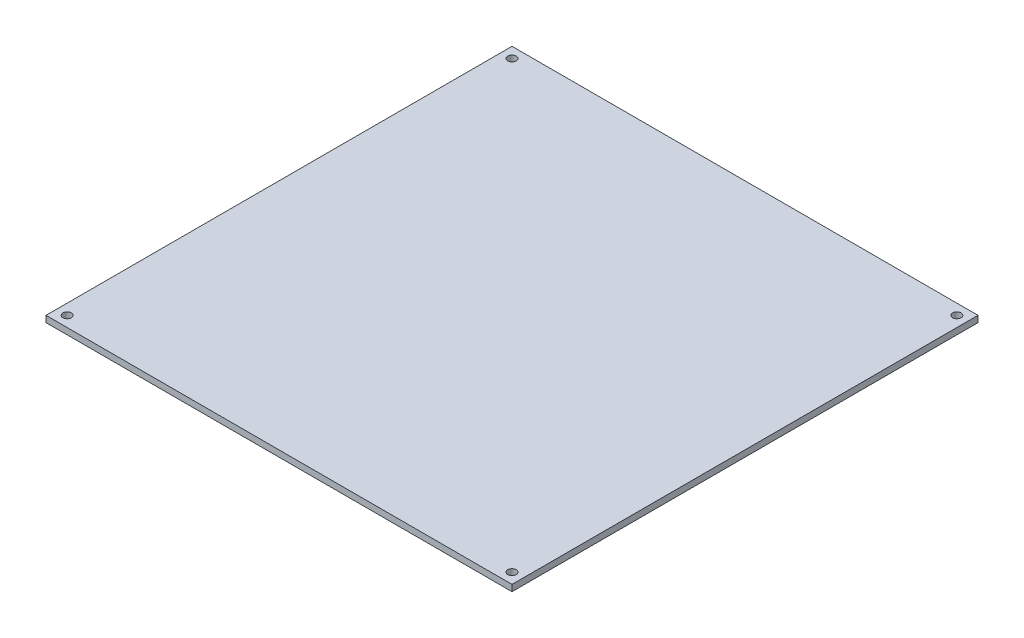
from build123d import *

# Parameters (mm, degrees)
SKETCH1_W           = 220
SKETCH1_H           = 220
SKETCH1_R           = 2
BOSS_EXTRUDE1_DEPTH = 3


with BuildPart() as part:
    # Sketch1 → Boss-Extrude1 (new body)
    with BuildSketch(Plane(origin=(0, 0, 0), x_dir=(1, 0, 0), z_dir=(0, 1, 0))):
        Rectangle(SKETCH1_W, SKETCH1_H)
        with Locations(Location((105, 105, 0), (0, 0, 270))):
            Circle(SKETCH1_R, mode=Mode.SUBTRACT)
        with Locations(Location((105, -105, 0), (0, 0, 270))):
            Circle(SKETCH1_R, mode=Mode.SUBTRACT)
        with Locations(Location((-105, -105, 0), (0, 0, 270))):
            Circle(SKETCH1_R, mode=Mode.SUBTRACT)
        with Locations(Location((-105, 105, 0), (0, 0, 270))):
            Circle(SKETCH1_R, mode=Mode.SUBTRACT)
    extrude(amount=BOSS_EXTRUDE1_DEPTH)


solid = part.part
